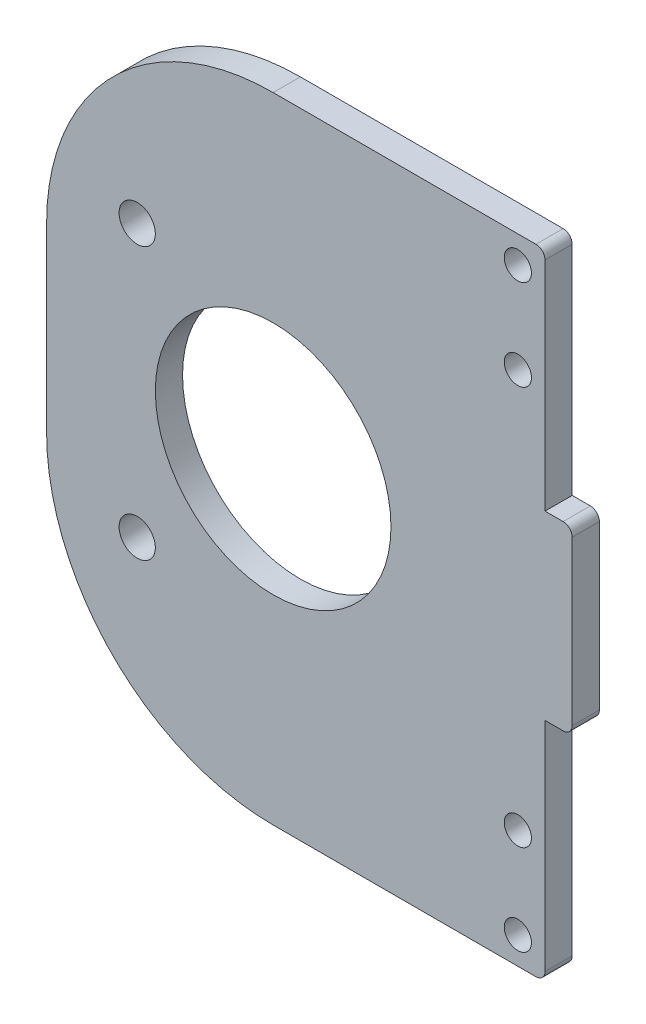
from build123d import *

# Parameters (mm, degrees)
SKETCH_1_W          = 55
SKETCH_1_H          = 70
EXTRUDE_1_DEPTH     = 3
SKETCH_3_R          = 13
CUT_EXTRUDE_1_DEPTH = 45.612218057
SKETCH_4_R          = 1.5
CUT_EXTRUDE_2_DEPTH = 45.612218057
SKETCH_5_W          = 3
SKETCH_5_H          = 20
EXTRUDE_2_DEPTH     = 3
FILLET_1_R          = 1
FILLET_2_R          = 25
SKETCH_6_R          = 2
CUT_EXTRUDE_3_DEPTH = 47.521500406


with BuildPart() as part:
    # 草图1 → 凸台-拉伸1 (new body)
    with BuildSketch(Plane.XY):
        Rectangle(SKETCH_1_W, SKETCH_1_H)
    extrude(amount=EXTRUDE_1_DEPTH)

    # 草图3 → 切除-拉伸1 (cut, through all)
    with BuildSketch(Plane(origin=(0, 0, 0), x_dir=(-1, 0, 0), z_dir=(0, 0, -1))):
        with Locations((2.5, 0)):
            Circle(SKETCH_3_R)
    extrude(amount=-CUT_EXTRUDE_1_DEPTH, mode=Mode.SUBTRACT)

    # 草图4 → 切除-拉伸2 (cut, through all)
    with BuildSketch(Plane.XY.offset(3)):
        with Locations((24.5, 32)):
            Circle(SKETCH_4_R)
        with Locations((24.5, 22)):
            Circle(SKETCH_4_R)
        with Locations(Location((24.5, -22, 0), (0, 0, 180))):
            Circle(SKETCH_4_R)
        with Locations(Location((24.5, -32, 0), (0, 0, 180))):
            Circle(SKETCH_4_R)
    extrude(amount=-CUT_EXTRUDE_2_DEPTH, mode=Mode.SUBTRACT)

    # 草图5 → 凸台-拉伸2 (add)
    with BuildSketch(Plane.XY.offset(3)):
        with Locations((29, 0)):
            Rectangle(SKETCH_5_W, SKETCH_5_H)
    extrude(amount=-EXTRUDE_2_DEPTH)

    # 圆角1
    fillet_1_edges = [part.edges().sort_by_distance(p)[0] for p in [
        (30.5, 10, 1.5),
        (30.5, -10, 1.5),
        (27.5, -35, 1.5),
        (27.5, 35, 1.5),
    ]]
    fillet(fillet_1_edges, radius=FILLET_1_R)

    # 圆角2
    fillet_2_edges = [part.edges().sort_by_distance(p)[0] for p in [
        (-27.5, -35, 1.5),
        (-27.5, 35, 1.5),
    ]]
    fillet(fillet_2_edges, radius=FILLET_2_R)

    # 草图6 → 切除-拉伸3 (cut, through all)
    with BuildSketch(Plane(origin=(0, 0, 0), x_dir=(-1, 0, 0), z_dir=(0, 0, -1))):
        with Locations((17.5, 15)):
            Circle(SKETCH_6_R)
        with Locations(Location((17.5, -15, 0), (0, 0, 180))):
            Circle(SKETCH_6_R)
    extrude(amount=-CUT_EXTRUDE_3_DEPTH, mode=Mode.SUBTRACT)


solid = part.part
